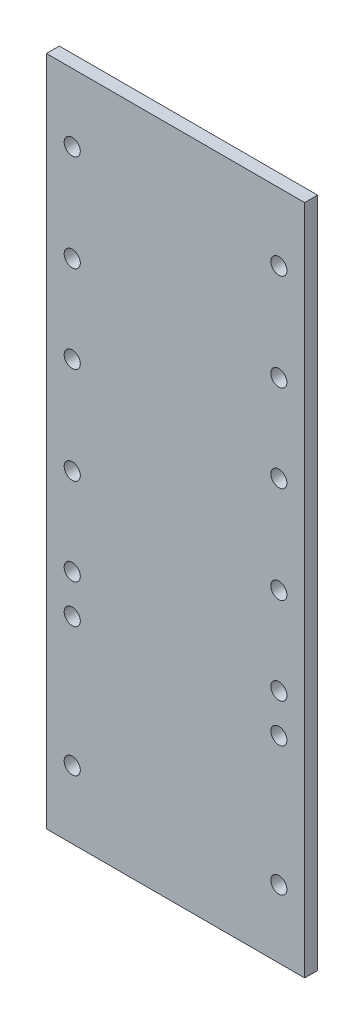
from build123d import *

# Parameters (mm, degrees)
ESBO_O1_W                = 80
ESBO_O1_H                = 208
ESBO_O1_R                = 2.5
RESSALTO_EXTRUS_O1_DEPTH = 4


with BuildPart() as part:
    # Esboço1 → Ressalto-extrusão1 (new body)
    with BuildSketch(Plane.XY):
        with Locations((57.90816081, -87.750943238)):
            Rectangle(ESBO_O1_W, ESBO_O1_H)
        with Locations((25.90816081, -4.750943238)):
            Circle(ESBO_O1_R, mode=Mode.SUBTRACT)
        with Locations((89.90816081, -4.750943238)):
            Circle(ESBO_O1_R, mode=Mode.SUBTRACT)
        with Locations((89.90816081, -170.750943238)):
            Circle(ESBO_O1_R, mode=Mode.SUBTRACT)
        with Locations((25.90816081, -170.750943238)):
            Circle(ESBO_O1_R, mode=Mode.SUBTRACT)
        with Locations((89.90816081, -130.750943238)):
            Circle(ESBO_O1_R, mode=Mode.SUBTRACT)
        with Locations((25.90816081, -130.750943238)):
            Circle(ESBO_O1_R, mode=Mode.SUBTRACT)
        with Locations((89.90816081, -118.750943238)):
            Circle(ESBO_O1_R, mode=Mode.SUBTRACT)
        with Locations((25.90816081, -118.750943238)):
            Circle(ESBO_O1_R, mode=Mode.SUBTRACT)
        with Locations((89.90816081, -61.750943238)):
            Circle(ESBO_O1_R, mode=Mode.SUBTRACT)
        with Locations((25.90816081, -61.750943238)):
            Circle(ESBO_O1_R, mode=Mode.SUBTRACT)
        with Locations((89.90816081, -34.750943238)):
            Circle(ESBO_O1_R, mode=Mode.SUBTRACT)
        with Locations((25.90816081, -34.750943238)):
            Circle(ESBO_O1_R, mode=Mode.SUBTRACT)
        with Locations((89.90816081, -91.750943238)):
            Circle(ESBO_O1_R, mode=Mode.SUBTRACT)
        with Locations((25.90816081, -91.750943238)):
            Circle(ESBO_O1_R, mode=Mode.SUBTRACT)
    extrude(amount=RESSALTO_EXTRUS_O1_DEPTH)


solid = part.part
